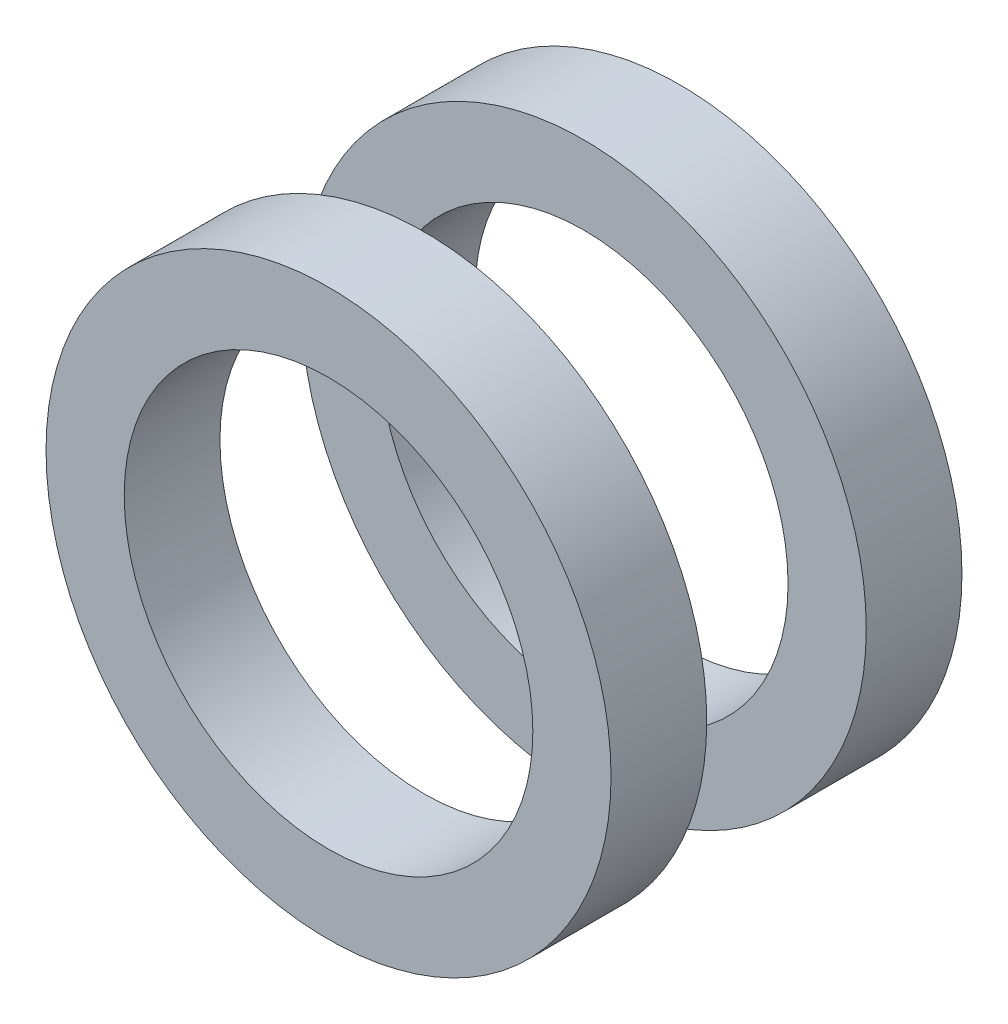
from build123d import *

# Parameters (mm, degrees)
ENDTURN_R_START = 15
SKETCH_1_R      = 53.130769231
SKETCH_1_R_2    = 38.423076923
ENDTURN_R_DEPTH = 18
ENDTURN_L_START = -33
SKETCH_2_R      = 53.130769231
SKETCH_2_R_2    = 38.423076923
ENDTURN_L_DEPTH = 18


with BuildPart() as part:
    # Эскиз1 → Endturn_R (new body)
    with BuildSketch(Plane.XY.offset(ENDTURN_R_START)):
        Circle(SKETCH_1_R)
        Circle(SKETCH_1_R_2, mode=Mode.SUBTRACT)
    extrude(amount=ENDTURN_R_DEPTH)


with BuildPart() as body_2:
    # Эскиз2 → Endturn_L (new body)
    with BuildSketch(Plane.XY.offset(ENDTURN_L_START)):
        Circle(SKETCH_2_R)
        Circle(SKETCH_2_R_2, mode=Mode.SUBTRACT)
    extrude(amount=ENDTURN_L_DEPTH)


solid = Compound([part.part, body_2.part])
